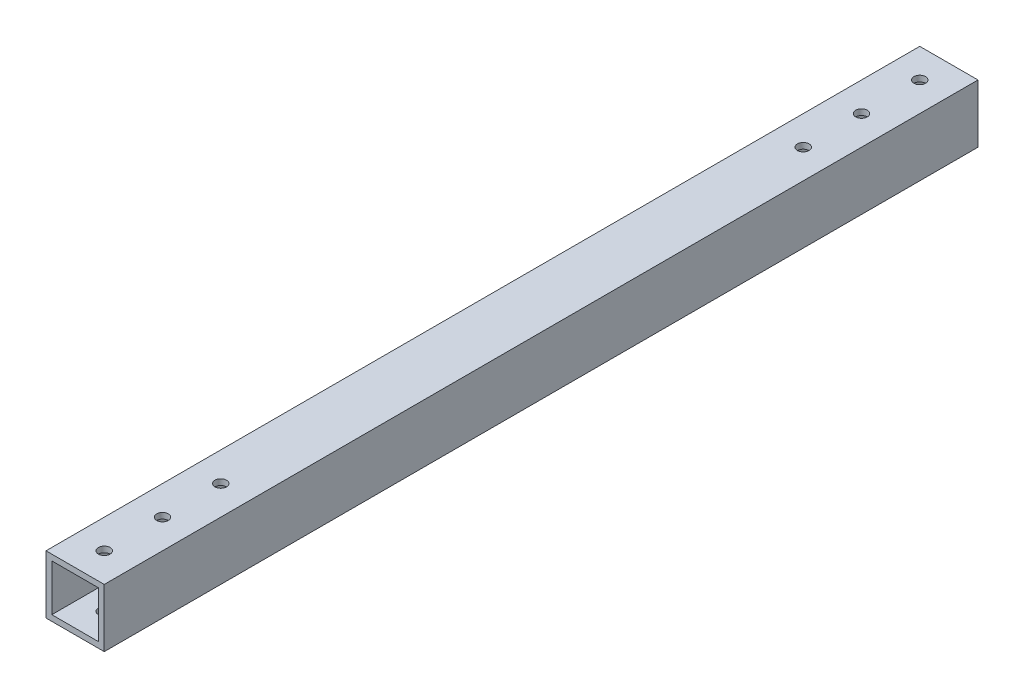
from build123d import *

# Parameters (mm, degrees)
SKETCH_1_W          = 20
SKETCH_1_H          = 20
SKETCH_1_W_2        = 16
SKETCH_1_H_2        = 16
EXTRUDE_1_DEPTH     = 300
SKETCH_2_R          = 2
CUT_EXTRUDE_1_DEPTH = 302.330383466


with BuildPart() as part:
    # 草图1 → 拉伸-薄壁1 (new body)
    with BuildSketch(Plane.XY):
        with Locations((10, 10)):
            Rectangle(SKETCH_1_W, SKETCH_1_H)
        with Locations((10, 10)):
            Rectangle(SKETCH_1_W_2, SKETCH_1_H_2, mode=Mode.SUBTRACT)
    extrude(amount=EXTRUDE_1_DEPTH)

    # 草图2 → 切除-拉伸1 (cut, through all)
    with BuildSketch(Plane(origin=(0, 20, 0), x_dir=(1, 0, 0), z_dir=(0, 1, 0))):
        with Locations(Location((10, -290, 0), (0, 0, 270))):
            Circle(SKETCH_2_R)
        with Locations(Location((10, -270, 0), (0, 0, 270))):
            Circle(SKETCH_2_R)
        with Locations(Location((10, -250, 0), (0, 0, 270))):
            Circle(SKETCH_2_R)
        with Locations(Location((10, -10, 0), (0, 0, 90))):
            Circle(SKETCH_2_R)
        with Locations(Location((10, -30, 0), (0, 0, 90))):
            Circle(SKETCH_2_R)
        with Locations(Location((10, -50, 0), (0, 0, 90))):
            Circle(SKETCH_2_R)
    extrude(amount=-CUT_EXTRUDE_1_DEPTH, mode=Mode.SUBTRACT)


solid = part.part
